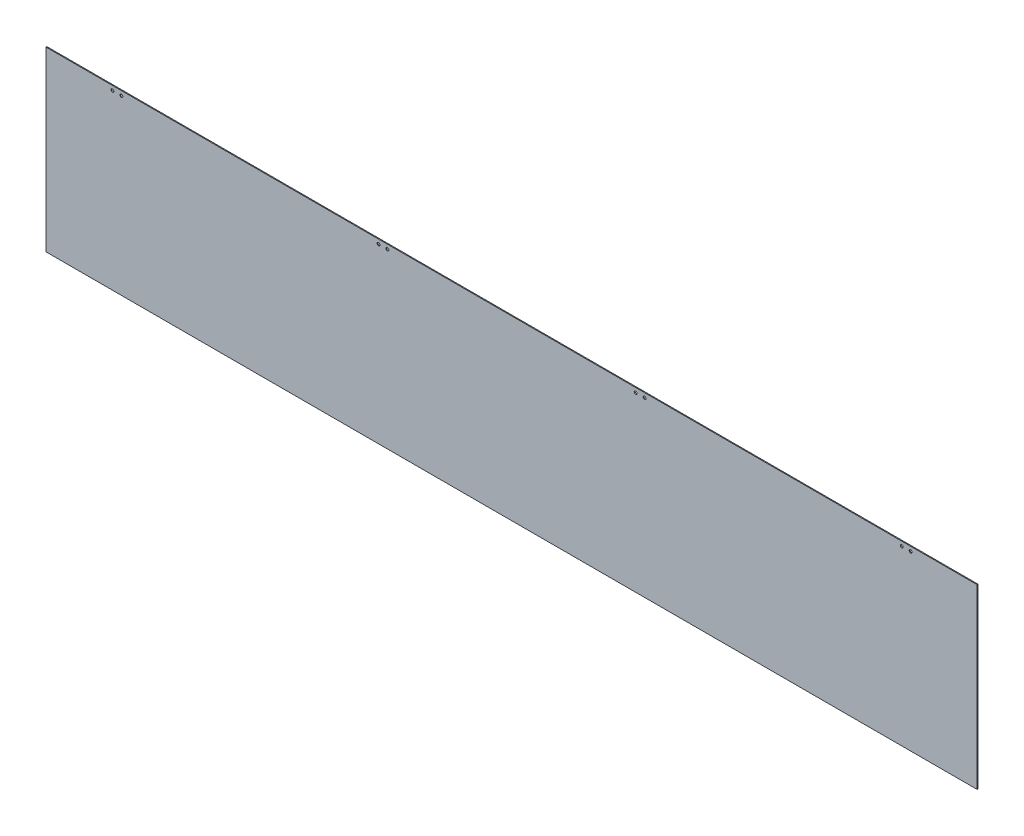
from build123d import *

# Parameters (mm, degrees)
SKETCH1_W             = 1050
SKETCH1_H             = 200
BOSS_EXTRUDE1_DEPTH   = 1
M4X0_7_TAPPED_HOLE1_D = 3.3


with BuildPart() as part:
    # Sketch1 → Boss-Extrude1 (new body)
    with BuildSketch(Plane.XY):
        Rectangle(SKETCH1_W, SKETCH1_H)
    extrude(amount=BOSS_EXTRUDE1_DEPTH)

    # M4x0.7 Tapped Hole1 (through all)
    with Locations(Plane.XY.offset(1)):
        with Locations((-450, 95), (-440, 95), (-150, 95), (-140, 95)):
            m4x0_7_tapped_hole1 = Hole(M4X0_7_TAPPED_HOLE1_D / 2)

    # Mirror1: M4x0.7 Tapped Hole1 across plane
    add(m4x0_7_tapped_hole1.mirror(Plane(origin=(0, 0, 0), x_dir=(0, 0, 1), z_dir=(1, 0, 0))), mode=Mode.SUBTRACT)


solid = part.part
